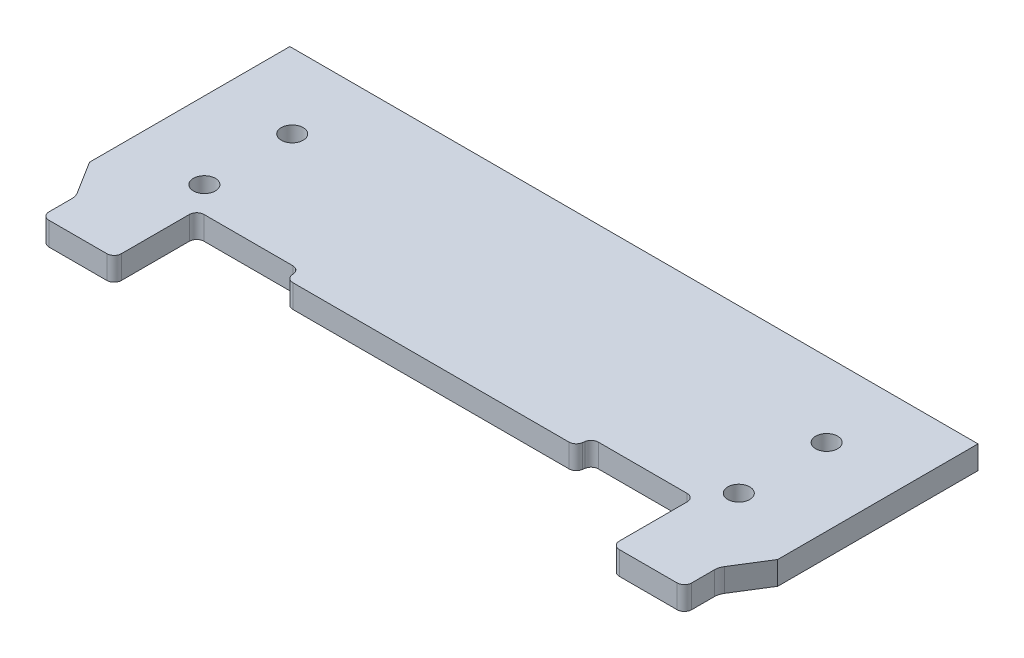
from build123d import *

# Parameters (mm, degrees)
BOSS_EXTRUDE4_DEPTH     = 1.5875
M3_CLEARANCE_HOLE3_D    = 3
M3_CLEARANCE_HOLE1_D    = 3.1
M3_CLEARANCE_HOLE4_D    = 2.95
M3_CLEARANCE_HOLE2_D    = 3.1
BOSS_EXTRUDE6_DEPTH     = 3.175
FILLET1_R               = 2
FILLET3_R               = 1
CUT_EXTRUDE4_DEPTH      = 121.250075508
CUT_EXTRUDE4_DEPTH_BACK = 121.250075508
SKETCH27_OUTSIDE_W      = 217.324
SKETCH27_OUTSIDE_H      = 197.151
SKETCH27_OUTSIDE_W_2    = 94
SKETCH27_OUTSIDE_H_2    = 40


with BuildPart() as part:
    # Sketch1 → Boss-Extrude4 (new, symmetric)
    with BuildSketch(Plane(origin=(0, 0, 0), x_dir=(1, 0, 0), z_dir=(0, 1, 0))):
        with BuildLine():
            Line((-62.799553621, 32.496136604), (-73.969425011, 32.691107434))
            Line((-73.969425011, 32.691107434), (-77.053684287, 35.88495141))
            ThreePointArc((-77.053684287, 35.88495141), (-84.36642289, 10.358894189), (-83.446216027, -16.178041625))
            Line((-83.446216027, -16.178041625), (-79.680911643, -13.825218315))
            Line((-79.680911643, -13.825218315), (-69.484649137, -16.179210996))
            Line((-69.484649137, -16.179210996), (-43.894490772, -57.132025032))
            Line((-43.894490772, -57.132025032), (-43.894490772, -64.826600275))
            Line((-43.894490772, -64.826600275), (-43.094490772, -64.826600275))
            Line((-43.094490772, -64.826600275), (-34, -64.826600275))
            Line((-34, -64.826600275), (-34, -55.55))
            Line((-34, -55.55), (-34, -53.55))
            Line((-34, -53.55), (-20, -53.55))
            Line((-20, -53.55), (-19.718918331, -55.55))
            Line((-19.718918331, -55.55), (19.718918331, -55.55))
            Line((19.718918331, -55.55), (20, -53.55))
            Line((20, -53.55), (34, -53.55))
            Line((34, -53.55), (34, -55.55))
            Line((34, -55.55), (34, -64.826600275))
            Line((34, -64.826600275), (43.094490772, -64.826600275))
            Line((43.094490772, -64.826600275), (43.894490772, -64.826600275))
            Line((43.894490772, -64.826600275), (43.894490772, -57.132025032))
            Line((43.894490772, -57.132025032), (69.484649137, -16.179210996))
            Line((69.484649137, -16.179210996), (79.680911643, -13.825218315))
            Line((79.680911643, -13.825218315), (83.446216027, -16.178041625))
            ThreePointArc((83.446216027, -16.178041625), (84.610662337, -8.126242604), (85, 0))
            ThreePointArc((85, 0), (82.98964744, 18.377116688), (77.053684287, 35.88495141))
            Line((77.053684287, 35.88495141), (73.969425011, 32.691107434))
            Line((73.969425011, 32.691107434), (62.799553621, 32.496136604))
            Line((62.799553621, 32.496136604), (30.284668021, 63.895396642))
            Line((30.284668021, 63.895396642), (30.089697191, 75.065268032))
            Line((30.089697191, 75.065268032), (33.173956467, 78.259112008))
            ThreePointArc((33.173956467, 78.259112008), (0, 85), (-33.173956467, 78.259112008))
            Line((-33.173956467, 78.259112008), (-30.089697191, 75.065268032))
            Line((-30.089697191, 75.065268032), (-30.284668021, 63.895396642))
            Line((-30.284668021, 63.895396642), (-62.799553621, 32.496136604))
        make_face()
    extrude(amount=BOSS_EXTRUDE4_DEPTH, both=True)

    # M3 Clearance Hole3 (through all)
    with Locations(Plane(origin=(0, -1.5875, 0), x_dir=(-1, 0, 0), z_dir=(0, -1, 0))):
        with Locations((36.5, -50), (36.5, -38), (-36.5, -50), (-36.5, -38)):
            Hole(M3_CLEARANCE_HOLE3_D / 2)

    # M3 Clearance Hole1 (through all)
    with Locations(Plane(origin=(0, 1.5875, 0), x_dir=(1, 0, 0), z_dir=(0, 1, 0))):
        with Locations((-78.542321426, -8.49139241), (78.542321426, -8.49139241), (74.155025063, 27.240269049), (-74.155025063, 27.240269049)):
            Hole(M3_CLEARANCE_HOLE1_D / 2)

    # M3 Clearance Hole4 (through all)
    with Locations(Plane(origin=(0, -1.5875, 0), x_dir=(-1, 0, 0), z_dir=(0, -1, 0))):
        with Locations((-67.099301622, -15.278865202), (-50.141885166, -42.416404279), (-61.062544382, 30.698137949), (-38.043670771, 52.927205804), (50.141885166, -42.416404279), (67.099301622, -15.278865202), (38.043670771, 52.927205804), (61.062544382, 30.698137949)):
            Hole(M3_CLEARANCE_HOLE4_D / 2)

    # M3 Clearance Hole2 (through all)
    with Locations(Plane(origin=(0, 1.5875, 0), x_dir=(1, 0, 0), z_dir=(0, 1, 0))):
        with Locations((27, 76.497766718), (-27, 76.497766718)):
            Hole(M3_CLEARANCE_HOLE2_D / 2)

    # Sketch22 → Boss-Extrude6 (add)
    with BuildSketch(Plane(origin=(0, 1.5875, 0), x_dir=(1, 0, 0), z_dir=(0, 1, 0))):
        Polygon((65.061950694, 32.535626892), (30.245177733, 66.157793715), (30.284668021, 63.895396642), (62.799553621, 32.496136604), align=None)
        Polygon((-30.284668021, 63.895396642), (-30.245177733, 66.157793715), (-65.061950694, 32.535626892), (-62.799553621, 32.496136604), align=None)
        Polygon((43.894490772, -60.151352895), (71.689396914, -15.670204865), (69.484649137, -16.179210996), (43.894490772, -57.132025032), align=None)
        Polygon((-69.484649137, -16.179210996), (-71.689396914, -15.670204865), (-43.894490772, -60.151352895), (-43.894490772, -57.132025032), align=None)
    extrude(amount=-BOSS_EXTRUDE6_DEPTH)

    # Fillet1
    fillet1_edges = [part.edges().sort_by_distance(p)[0] for p in [
        (-30.245177733, -0.79375, -66.157793715),
        (-65.061950694, -0.79375, -32.535626892),
        (-71.689396914, -0.79375, 15.670204865),
        (-43.894490772, -0.79375, 60.151352895),
        (43.894490772, 0.79375, 60.151352895),
        (71.689396914, 0.79375, 15.670204865),
        (65.061950694, -0.79375, -32.535626892),
        (30.245177733, 0.79375, -66.157793715),
        (30.089697191, -0.79375, -75.065268032),
        (73.969425011, -0.79375, -32.691107434),
        (79.680911643, -0.79375, 13.825218315),
        (-79.680911643, -0.79375, 13.825218315),
        (-73.969425011, -0.79375, -32.691107434),
        (-30.089697191, -0.79375, -75.065268032),
    ]]
    fillet(fillet1_edges, radius=FILLET1_R)

    # Fillet3
    fillet3_edges = [part.edges().sort_by_distance(p)[0] for p in [
        (33.173956467, -0.79375, -78.259112008),
        (77.053684287, 0.79375, -35.88495141),
        (83.446216027, -0.79375, 16.178041625),
        (43.894490772, -0.79375, 64.826600275),
        (34, 0.79375, 64.826600275),
        (34, -0.79375, 53.55),
        (20, -0.79375, 53.55),
        (19.718918331, 0.79375, 55.55),
        (-19.718918331, 0.79375, 55.55),
        (-20, -0.79375, 53.55),
        (-34, -0.79375, 53.55),
        (-34, 0.79375, 64.826600275),
        (-43.894490772, -0.79375, 64.826600275),
        (-83.446216027, -0.79375, 16.178041625),
        (-77.053684287, -0.79375, -35.88495141),
        (-33.173956467, -0.79375, -78.259112008),
    ]]
    fillet(fillet3_edges, radius=FILLET3_R)

    # Sketch27 outside → Cut-Extrude4 (cut, two sides: drawn at the far end of the back side and taken through both)
    with BuildSketch(Plane(origin=(0, 1.5875, 0), x_dir=(1, 0, 0), z_dir=(0, 1, 0)).offset(-CUT_EXTRUDE4_DEPTH_BACK)):
        with Locations((0, 10.0865)):
            Rectangle(SKETCH27_OUTSIDE_W, SKETCH27_OUTSIDE_H)
        with Locations((0, -47.826600275)):
            Rectangle(SKETCH27_OUTSIDE_W_2, SKETCH27_OUTSIDE_H_2, mode=Mode.SUBTRACT)
    extrude(amount=CUT_EXTRUDE4_DEPTH + CUT_EXTRUDE4_DEPTH_BACK, mode=Mode.SUBTRACT)


solid = part.part
